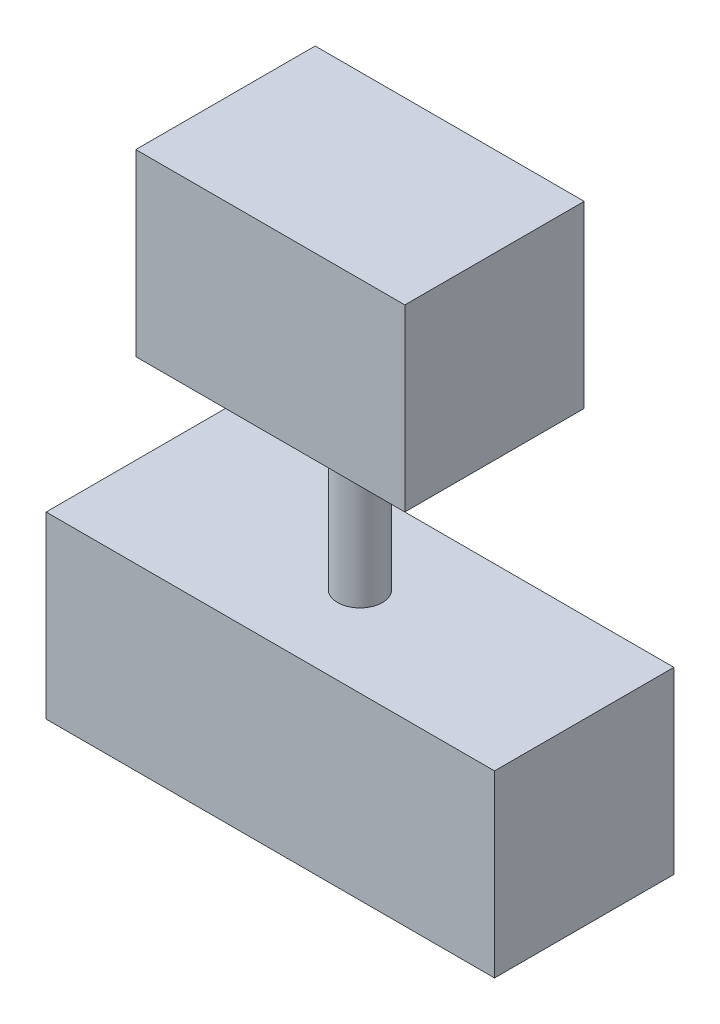
from build123d import *

# Parameters (mm, degrees)
SKETCH1_W           = 50
SKETCH1_H           = 20
BOSS_EXTRUDE1_DEPTH = 20
SKETCH2_R           = 2.5
BOSS_EXTRUDE2_DEPTH = 20
SKETCH3_W           = 30
SKETCH3_H           = 20
BOSS_EXTRUDE3_DEPTH = 20


with BuildPart() as part:
    # Sketch1 → Boss-Extrude1 (new body)
    with BuildSketch(Plane.XY):
        Rectangle(SKETCH1_W, SKETCH1_H)
    extrude(amount=BOSS_EXTRUDE1_DEPTH)


with BuildPart() as body_2:
    # Sketch2 → Boss-Extrude2 (new body)
    with BuildSketch(Plane(origin=(0, 10, 0), x_dir=(1, 0, 0), z_dir=(0, 1, 0))):
        with Locations(Location((0, -10, 0), (0, 0, 270))):
            Circle(SKETCH2_R)
    extrude(amount=BOSS_EXTRUDE2_DEPTH)


with BuildPart() as body_3:
    # Sketch3 → Boss-Extrude3 (new body)
    with BuildSketch(Plane.XY):
        with Locations((0, 40)):
            Rectangle(SKETCH3_W, SKETCH3_H)
    extrude(amount=BOSS_EXTRUDE3_DEPTH)


solid = Compound([part.part, body_2.part, body_3.part])
